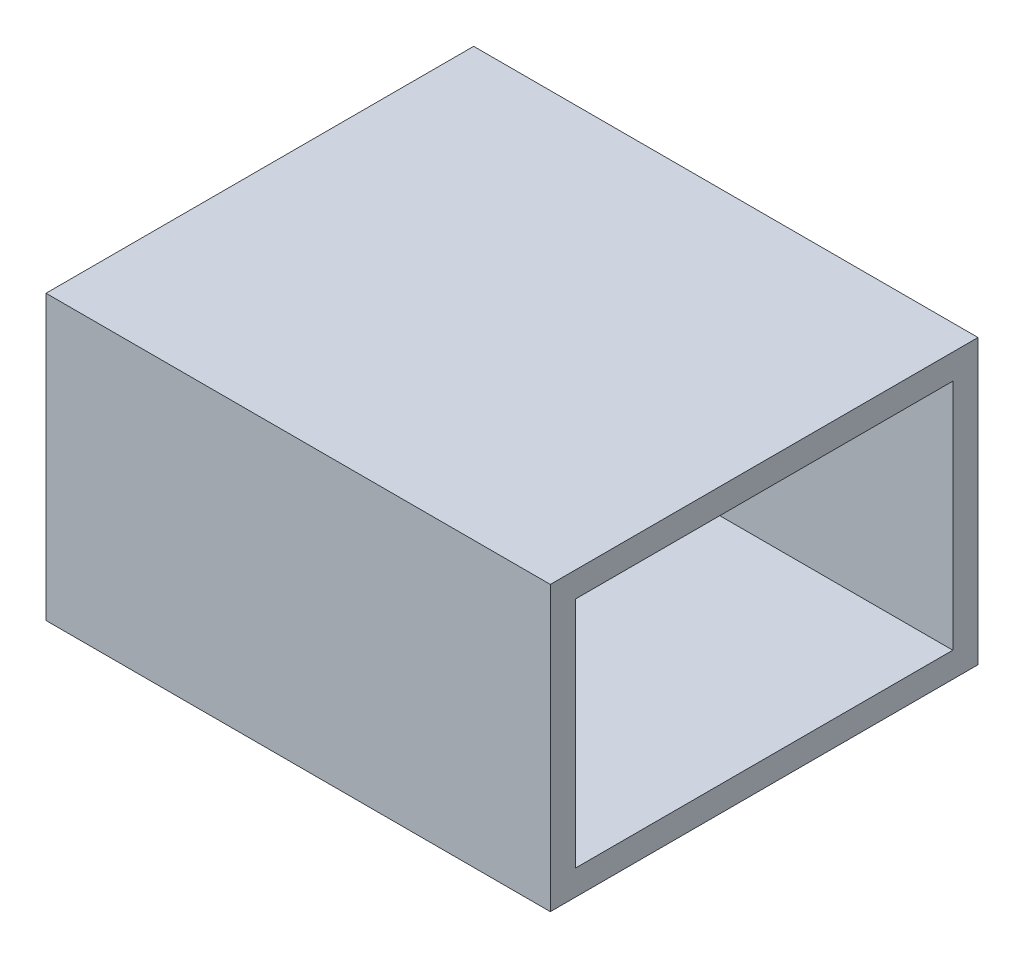
from build123d import *

# Parameters (mm, degrees)
SKETCH1_W           = 215.392
SKETCH1_H           = 142.748
SKETCH1_W_2         = 189.992
SKETCH1_H_2         = 117.348
BOSS_EXTRUDE1_DEPTH = 254


with BuildPart() as part:
    # Sketch1 → Boss-Extrude1 (new body)
    with BuildSketch(Plane(origin=(0, 0, 0), x_dir=(0, 0, -1), z_dir=(1, 0, 0))):
        with Locations((94.996, -58.674)):
            Rectangle(SKETCH1_W, SKETCH1_H)
        with Locations((94.996, -58.674)):
            Rectangle(SKETCH1_W_2, SKETCH1_H_2, mode=Mode.SUBTRACT)
    extrude(amount=BOSS_EXTRUDE1_DEPTH)


solid = part.part
